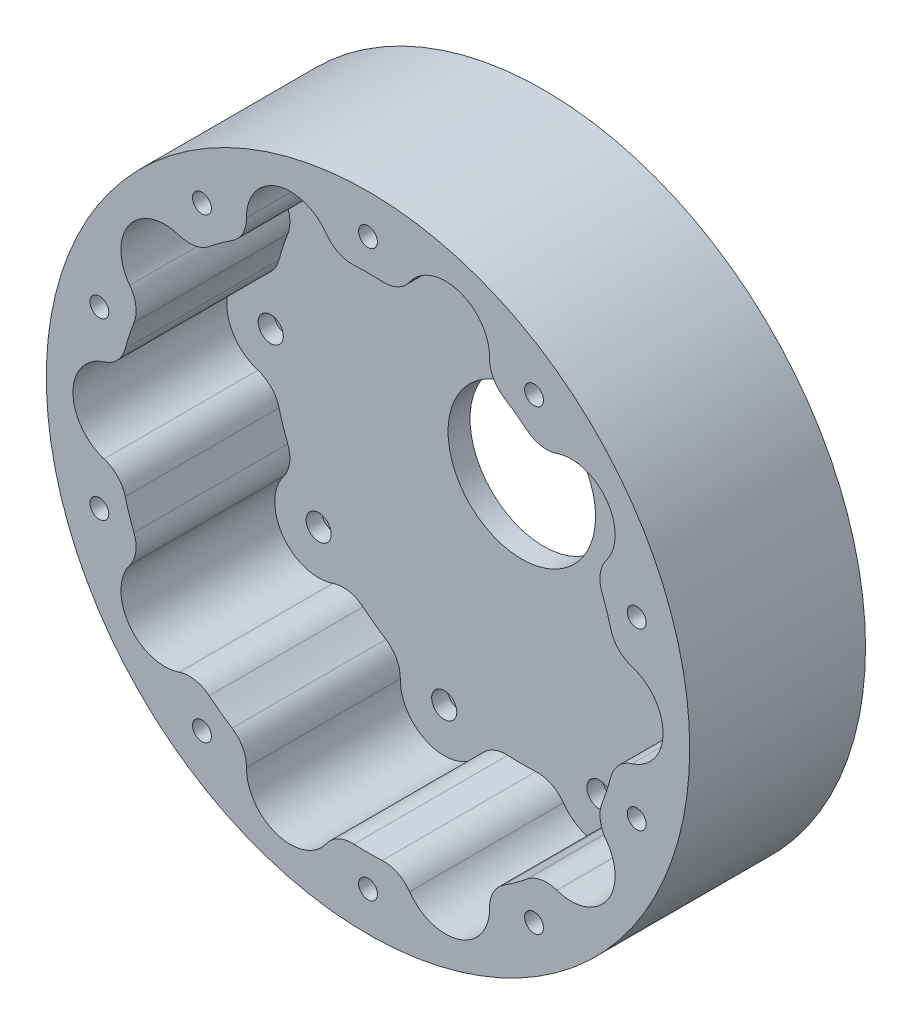
from build123d import *

# Parameters (mm, degrees)
SKETCH1_R           = 102.5
BOSS_EXTRUDE1_DEPTH = 7
SKETCH3_R           = 23.5
CUT_EXTRUDE1_DEPTH  = 146.125807491
SKETCH4_R           = 4
CUT_EXTRUDE2_DEPTH  = 5
CIRPATTERN1_COUNT   = 10
SKETCH5_R           = 102.5
BOSS_EXTRUDE2_DEPTH = 49
SKETCH6_R           = 3
CUT_EXTRUDE5_DEPTH  = 156.397876433


with BuildPart() as part:
    # Sketch1 → Boss-Extrude1 (new body)
    with BuildSketch(Plane.XY):
        Circle(SKETCH1_R)
    extrude(amount=BOSS_EXTRUDE1_DEPTH)

    # Sketch3 → Cut-Extrude1 (cut, through all)
    with BuildSketch(Plane.XY.offset(7)):
        Circle(SKETCH3_R)
    extrude(amount=-CUT_EXTRUDE1_DEPTH, mode=Mode.SUBTRACT)

    # Sketch4 → Cut-Extrude2 (cut)
    with BuildSketch(Plane.XY.offset(7)):
        with Locations((80, 0)):
            Circle(SKETCH4_R)
    cut_extrude2 = extrude(amount=-CUT_EXTRUDE2_DEPTH, mode=Mode.SUBTRACT)

    # CirPattern1: Cut-Extrude2 ×10 about axis
    cirpattern1_axis = Axis((0, 0, 0), (0, 0, 1))
    for i in range(1, CIRPATTERN1_COUNT):
        add(cut_extrude2.rotate(cirpattern1_axis, i * 360 / CIRPATTERN1_COUNT), mode=Mode.SUBTRACT)

    # Sketch5 → Boss-Extrude2 (add)
    with BuildSketch(Plane.XY.offset(7)):
        Circle(SKETCH5_R)
        with BuildLine():
            ThreePointArc((-13.256058456, 84.118628025), (-29.047597471, 89.399312532), (-38.719312427, 75.84511528))
            ThreePointArc((-38.719312427, 75.84511528), (-39.898528404, 70.960347818), (-43.304755731, 67.265876424))
            ThreePointArc((-43.304755731, 67.265876424), (-47.022820183, 64.72135955), (-50.59174464, 61.971569081))
            ThreePointArc((-50.59174464, 61.971569081), (-55.157977863, 59.873708832), (-60.168065566, 60.261683952))
            ThreePointArc((-60.168065566, 60.261683952), (-76.047597471, 55.251813715), (-75.905221984, 38.601346378))
            ThreePointArc((-75.905221984, 38.601346378), (-73.988033475, 33.956360727), (-74.572173468, 28.965340396))
            ThreePointArc((-74.572173468, 28.965340396), (-76.084521304, 24.72135955), (-77.355555556, 20.398971167))
            ThreePointArc((-77.355555556, 20.398971167), (-79.816624518, 16.017802027), (-84.097916667, 13.386824829))
            ThreePointArc((-84.097916667, 13.386824829), (-94, 0), (-84.097916667, -13.386824829))
            ThreePointArc((-84.097916667, -13.386824829), (-79.816624518, -16.017802027), (-77.355555556, -20.398971167))
            ThreePointArc((-77.355555556, -20.398971167), (-76.084521304, -24.72135955), (-74.572173468, -28.965340396))
            ThreePointArc((-74.572173468, -28.965340396), (-73.988033475, -33.956360727), (-75.905221984, -38.601346378))
            ThreePointArc((-75.905221984, -38.601346378), (-76.047597471, -55.251813715), (-60.168065566, -60.261683952))
            ThreePointArc((-60.168065566, -60.261683952), (-55.157977863, -59.873708832), (-50.59174464, -61.971569081))
            ThreePointArc((-50.59174464, -61.971569081), (-47.022820183, -64.72135955), (-43.304755731, -67.265876424))
            ThreePointArc((-43.304755731, -67.265876424), (-39.898528404, -70.960347818), (-38.719312427, -75.84511528))
            ThreePointArc((-38.719312427, -75.84511528), (-29.047597471, -89.399312532), (-13.256058456, -84.118628025))
            ThreePointArc((-13.256058456, -84.118628025), (-9.430858415, -80.859893896), (-4.503606821, -79.873133941))
            ThreePointArc((-4.503606821, -79.873133941), (0, -80), (4.503606821, -79.873133941))
            ThreePointArc((4.503606821, -79.873133941), (9.430858415, -80.859893896), (13.256058456, -84.118628025))
            ThreePointArc((13.256058456, -84.118628025), (29.047597471, -89.399312532), (38.719312427, -75.84511528))
            ThreePointArc((38.719312427, -75.84511528), (39.898528404, -70.960347818), (43.304755731, -67.265876424))
            ThreePointArc((43.304755731, -67.265876424), (47.022820183, -64.72135955), (50.59174464, -61.971569081))
            ThreePointArc((50.59174464, -61.971569081), (55.157977863, -59.873708832), (60.168065566, -60.261683952))
            ThreePointArc((60.168065566, -60.261683952), (76.047597471, -55.251813715), (75.905221984, -38.601346378))
            ThreePointArc((75.905221984, -38.601346378), (73.988033475, -33.956360727), (74.572173468, -28.965340396))
            ThreePointArc((74.572173468, -28.965340396), (76.084521304, -24.72135955), (77.355555556, -20.398971167))
            ThreePointArc((77.355555556, -20.398971167), (79.816624518, -16.017802027), (84.097916667, -13.386824829))
            ThreePointArc((84.097916667, -13.386824829), (94, 0), (84.097916667, 13.386824829))
            ThreePointArc((84.097916667, 13.386824829), (79.816624518, 16.017802027), (77.355555556, 20.398971167))
            ThreePointArc((77.355555556, 20.398971167), (76.084521304, 24.72135955), (74.572173468, 28.965340396))
            ThreePointArc((74.572173468, 28.965340396), (73.988033475, 33.956360727), (75.905221984, 38.601346378))
            ThreePointArc((75.905221984, 38.601346378), (76.047597471, 55.251813715), (60.168065566, 60.261683952))
            ThreePointArc((60.168065566, 60.261683952), (55.157977863, 59.873708832), (50.59174464, 61.971569081))
            ThreePointArc((50.59174464, 61.971569081), (47.022820183, 64.72135955), (43.304755731, 67.265876424))
            ThreePointArc((43.304755731, 67.265876424), (39.898528404, 70.960347818), (38.719312427, 75.84511528))
            ThreePointArc((38.719312427, 75.84511528), (29.047597471, 89.399312532), (13.256058456, 84.118628025))
            ThreePointArc((13.256058456, 84.118628025), (9.430858415, 80.859893896), (4.503606821, 79.873133941))
            ThreePointArc((4.503606821, 79.873133941), (0, 80), (-4.503606821, 79.873133941))
            ThreePointArc((-4.503606821, 79.873133941), (-9.430858415, 80.859893896), (-13.256058456, 84.118628025))
        make_face(mode=Mode.SUBTRACT)
    extrude(amount=BOSS_EXTRUDE2_DEPTH)

    # Sketch6 → Cut-Extrude5 (cut, through all)
    with BuildSketch(Plane.XY.offset(56)):
        with Locations((0, 90)):
            Circle(SKETCH6_R)
        with Locations((52.900672706, 72.811529494)):
            Circle(SKETCH6_R)
        with Locations((85.595086467, 27.811529494)):
            Circle(SKETCH6_R)
        with Locations((85.595086467, -27.811529494)):
            Circle(SKETCH6_R)
        with Locations((52.900672706, -72.811529494)):
            Circle(SKETCH6_R)
        with Locations((0, -90)):
            Circle(SKETCH6_R)
        with Locations((-52.900672706, -72.811529494)):
            Circle(SKETCH6_R)
        with Locations((-85.595086467, -27.811529494)):
            Circle(SKETCH6_R)
        with Locations((-85.595086467, 27.811529494)):
            Circle(SKETCH6_R)
        with Locations((-52.900672706, 72.811529494)):
            Circle(SKETCH6_R)
    extrude(amount=-CUT_EXTRUDE5_DEPTH, mode=Mode.SUBTRACT)


solid = part.part
